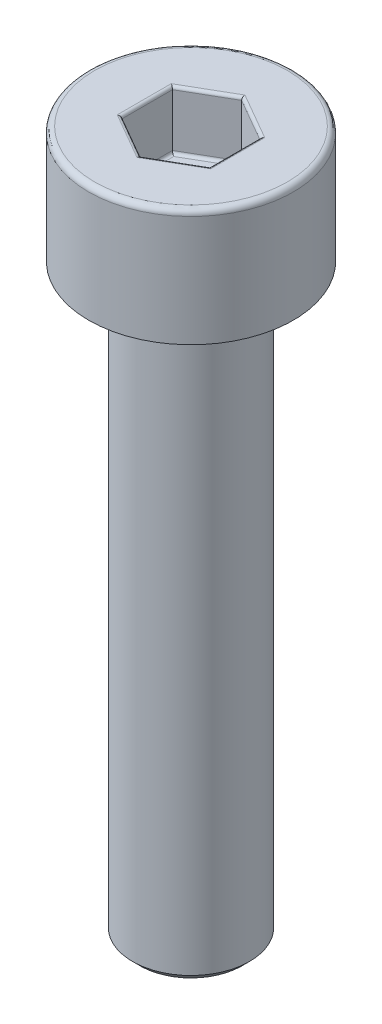
from build123d import *

# Parameters (mm, degrees)
CHAMFER1_SIZE      = 0.25
FILLET1_R          = 0.2
CUT_EXTRUDE1_DEPTH = 2
FILLET2_R          = 0.1


with BuildPart() as part:
    # Sketch1 → Revolve1 (revolve)
    with BuildSketch(Plane.XY, mode=Mode.PRIVATE) as revolve1_sk:
        Polygon((0, -24), (-2, -24), (-2, -4), (-3.5, -4), (-3.5, 0), (0, 0), align=None)
    revolve(revolve1_sk.sketch.rotate(Axis((0, 0, 0), (0, -1, 0)), 270), axis=Axis((0, 0, 0), (0, -1, 0)))

    # Chamfer1
    chamfer1_edges = [part.edges().sort_by_distance(p)[0] for p in [
        (0, -4, -2),
        (0, -24, -2),
    ]]
    chamfer(chamfer1_edges, length=CHAMFER1_SIZE)

    # Fillet1
    fillet1_edges = [part.edges().sort_by_distance(p)[0] for p in [
        (0, 0, -3.5),
    ]]
    fillet(fillet1_edges, radius=FILLET1_R)

    # Sketch2 → Cut-Extrude1 (cut)
    with BuildSketch(Plane(origin=(0, 0, 0), x_dir=(1, 0, 0), z_dir=(0, 1, 0))):
        Polygon((0, 1.732050808), (-1.5, 0.866025404), (-1.5, -0.866025404), (0, -1.732050808), (1.5, -0.866025404), (1.5, 0.866025404), align=None)
    extrude(amount=-CUT_EXTRUDE1_DEPTH, mode=Mode.SUBTRACT)

    # Fillet2
    fillet2_edges = [part.edges().sort_by_distance(p)[0] for p in [
        (0.75, -2, -1.299038106),
        (1.5, -2, 0),
        (0.75, -2, 1.299038106),
        (-0.75, -2, 1.299038106),
        (-1.5, -2, 0),
        (-0.75, -2, -1.299038106),
        (0.75, 0, -1.299038106),
        (-0.75, 0, -1.299038106),
        (-1.5, 0, 0),
        (-0.75, 0, 1.299038106),
        (0.75, 0, 1.299038106),
        (1.5, 0, 0),
    ]]
    fillet(fillet2_edges, radius=FILLET2_R)


solid = part.part
